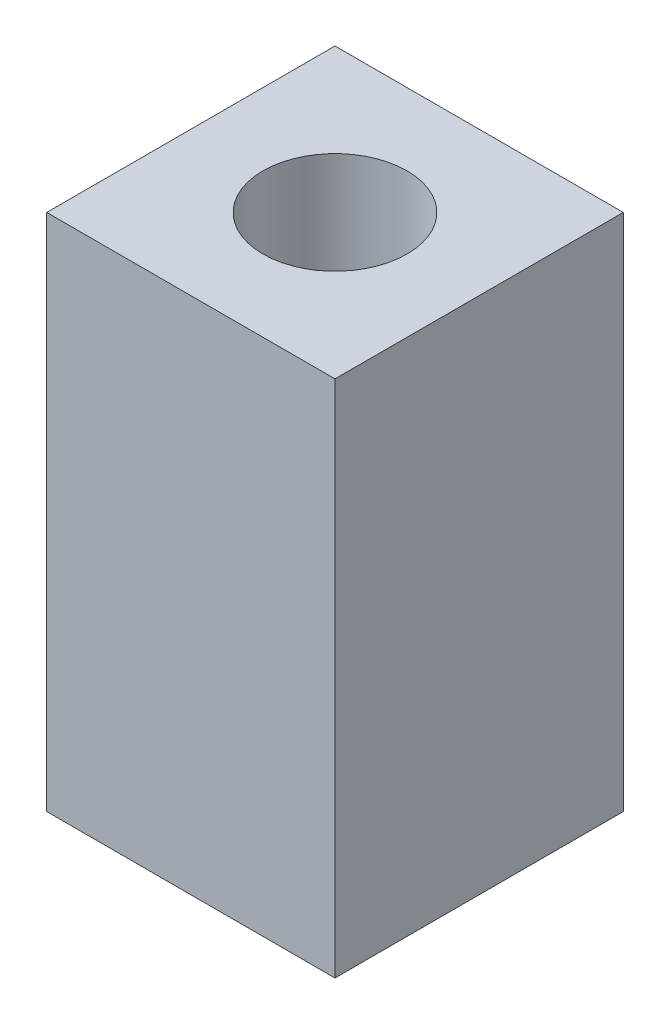
from build123d import *

# Parameters (mm, degrees)
SKETCH_1_W      = 6
SKETCH_1_H      = 6
SKETCH_1_R      = 1.5
EXTRUDE_1_DEPTH = 10.8


with BuildPart() as part:
    # Эскиз1 → Бобышка-Вытянуть1 (new body)
    with BuildSketch(Plane(origin=(0, 0, 0), x_dir=(1, 0, 0), z_dir=(0, 1, 0))):
        Rectangle(SKETCH_1_W, SKETCH_1_H)
        with Locations(Location((0, 0, 0), (0, 0, 90))):
            Circle(SKETCH_1_R, mode=Mode.SUBTRACT)
    extrude(amount=EXTRUDE_1_DEPTH)


solid = part.part
